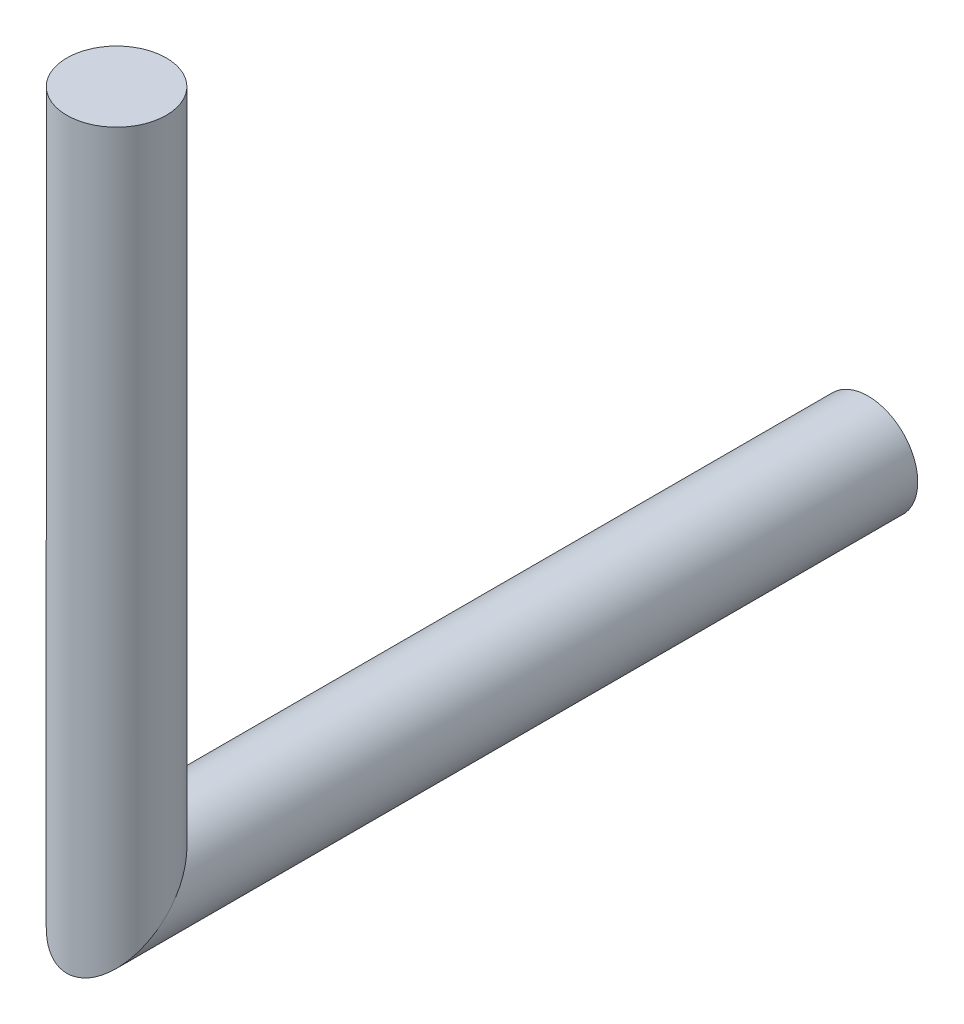
from build123d import *

# Parameters (mm, degrees)
SWEEP_2_PROFILE_R = 5


with BuildPart() as part:
    # 扫描2: sweep along a curve in space
    with BuildLine() as sweep_2_path:
        Line((0, 69.708885629, 0), (0, 0, 0))
        Line((0, 0, 0), (0, 0, -75.547004801))
    # 扫描2 profile (on start of the path) → 扫描2 (sweep)
    with BuildSketch(Plane(origin=(0, 69.708885629, 0), x_dir=(0, 0, -1), z_dir=(0, -1, 0))):
        Circle(SWEEP_2_PROFILE_R)
    sweep(path=sweep_2_path.line, transition=Transition.RIGHT)


solid = part.part
